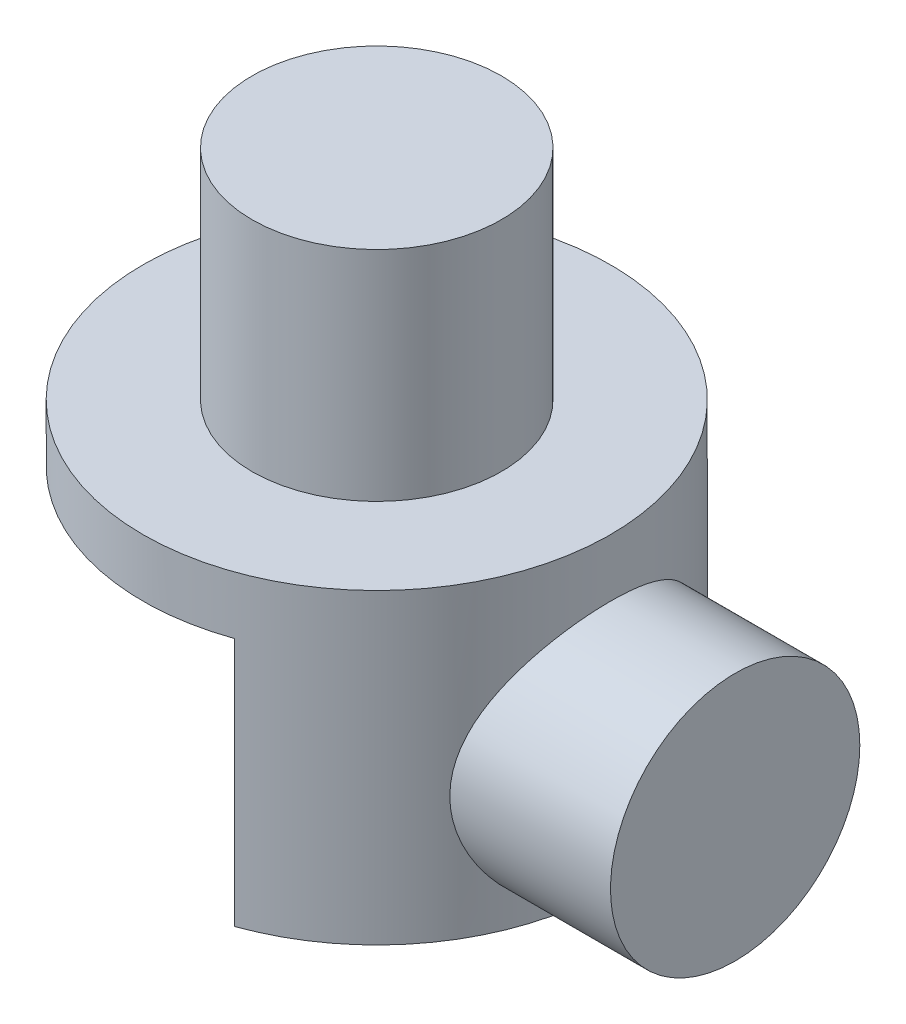
from build123d import *
from build123d.topology import SkipClean

# Parameters (mm, degrees)
SKETCH1_R           = 7.5
BOSS_EXTRUDE1_DEPTH = 1.85
BOSS_EXTRUDE2_START = 8
BOSS_EXTRUDE2_DEPTH = 8
SKETCH4_R           = 3.5
CUT_EXTRUDE1_DEPTH  = 14.285330256
SKETCH5_R           = 4
SKETCH5_R_2         = 3.5
BOSS_EXTRUDE3_DEPTH = 7
SKETCH6_R           = 4
BOSS_EXTRUDE4_DEPTH = 7
SKETCH7_R           = 4
BOSS_EXTRUDE5_DEPTH = 2


with BuildPart() as part:
    # Sketch1 → Boss-Extrude1 (new body)
    with BuildSketch(Plane(origin=(0, 0, 0), x_dir=(1, 0, 0), z_dir=(0, 1, 0))):
        with Locations(Location((0, 0, 0), (0, 0, 270))):
            Circle(SKETCH1_R)
    extrude(amount=BOSS_EXTRUDE1_DEPTH)

    # Sketch2 → Boss-Extrude2 (add)
    with SkipClean():  # the faces are left unmerged after this step: merging them gives an invalid solid
        with BuildSketch(Plane.XZ.offset(BOSS_EXTRUDE2_START)):
            with BuildLine():
                Line((2.5, 7.071067812), (2.5, -7.071067812))
                ThreePointArc((2.5, -7.071067812), (7.5, 0), (2.5, 7.071067812))
            make_face()
        extrude(amount=-BOSS_EXTRUDE2_DEPTH)

    # Sketch4 → Cut-Extrude1 (cut, through all)
    with SkipClean():  # the faces are left unmerged after this step: merging them gives an invalid solid
        with BuildSketch(Plane(origin=(0, 0, 0), x_dir=(0, 0, -1), z_dir=(1, 0, 0))):
            with Locations(Location((0, -4, 0), (0, 0, 270))):
                Circle(SKETCH4_R)
        extrude(amount=CUT_EXTRUDE1_DEPTH, mode=Mode.SUBTRACT)

    # Sketch5 → Boss-Extrude3 (add)
    with SkipClean():  # the faces are left unmerged after this step: merging them gives an invalid solid
        with BuildSketch(Plane.ZY.offset(-2.5)):
            with Locations((0, -4)):
                Circle(SKETCH5_R)
            with Locations((0, -4)):
                Circle(SKETCH5_R_2, mode=Mode.SUBTRACT)
        extrude(amount=-BOSS_EXTRUDE3_DEPTH)

    # Sketch6 → Boss-Extrude4 (add)
    with SkipClean():  # the faces are left unmerged after this step: merging them gives an invalid solid
        with BuildSketch(Plane(origin=(0, 1.85, 0), x_dir=(1, 0, 0), z_dir=(0, 1, 0))):
            with Locations(Location((0, 0, 0), (0, 0, 270))):
                Circle(SKETCH6_R)
        extrude(amount=BOSS_EXTRUDE4_DEPTH)

    # Sketch7 → Boss-Extrude5 (add)
    with SkipClean():  # the faces are left unmerged after this step: merging them gives an invalid solid
        with BuildSketch(Plane(origin=(9.5, 0, 0), x_dir=(0, 0, -1), z_dir=(1, 0, 0))):
            with Locations(Location((0, -4, 0), (0, 0, 270))):
                Circle(SKETCH7_R)
        extrude(amount=BOSS_EXTRUDE5_DEPTH)


solid = part.part
